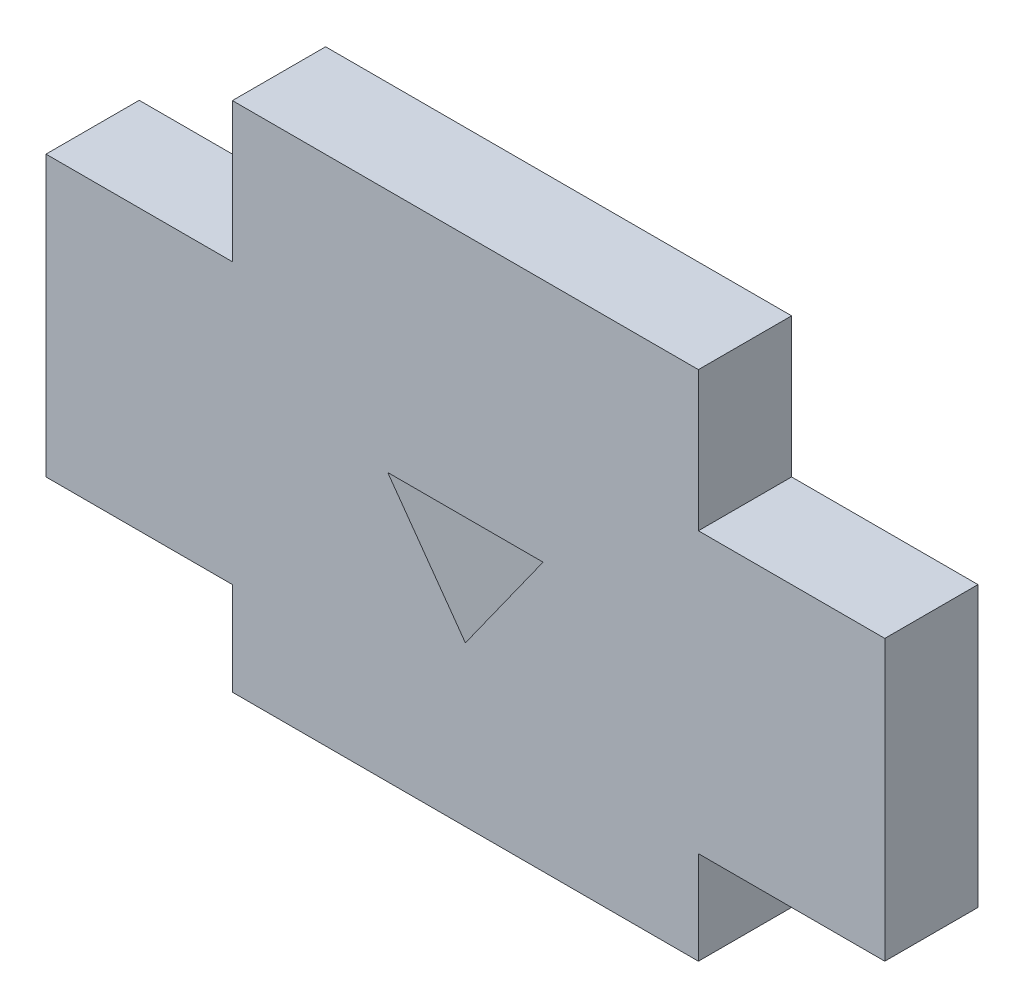
from build123d import *

# Parameters (mm, degrees)
BOSS_EXTRUDE1_DEPTH = 6


with BuildPart() as part:
    # Sketch1 → Boss-Extrude1 (new body)
    with BuildSketch(Plane.XY):
        Polygon((24.866162055, -35.317756725), (12.866162055, -35.317756725), (12.866162055, -26.332846246), (-17.133837945, -26.332846246), (-17.133837945, -35.317756725), (-29.133837945, -35.317756725), (-29.133837945, -53.317756725), (-17.133837945, -53.317756725), (-17.133837945, -59.317756725), (12.866162055, -59.317756725), (12.866162055, -53.317756725), (24.866162055, -53.317756725), align=None)
        Polygon((-7.133837945, -42.067756725), (-2.133837945, -49.067756725), (2.866162055, -42.067756725), align=None, mode=Mode.SUBTRACT)
    extrude(amount=BOSS_EXTRUDE1_DEPTH)


solid = part.part
